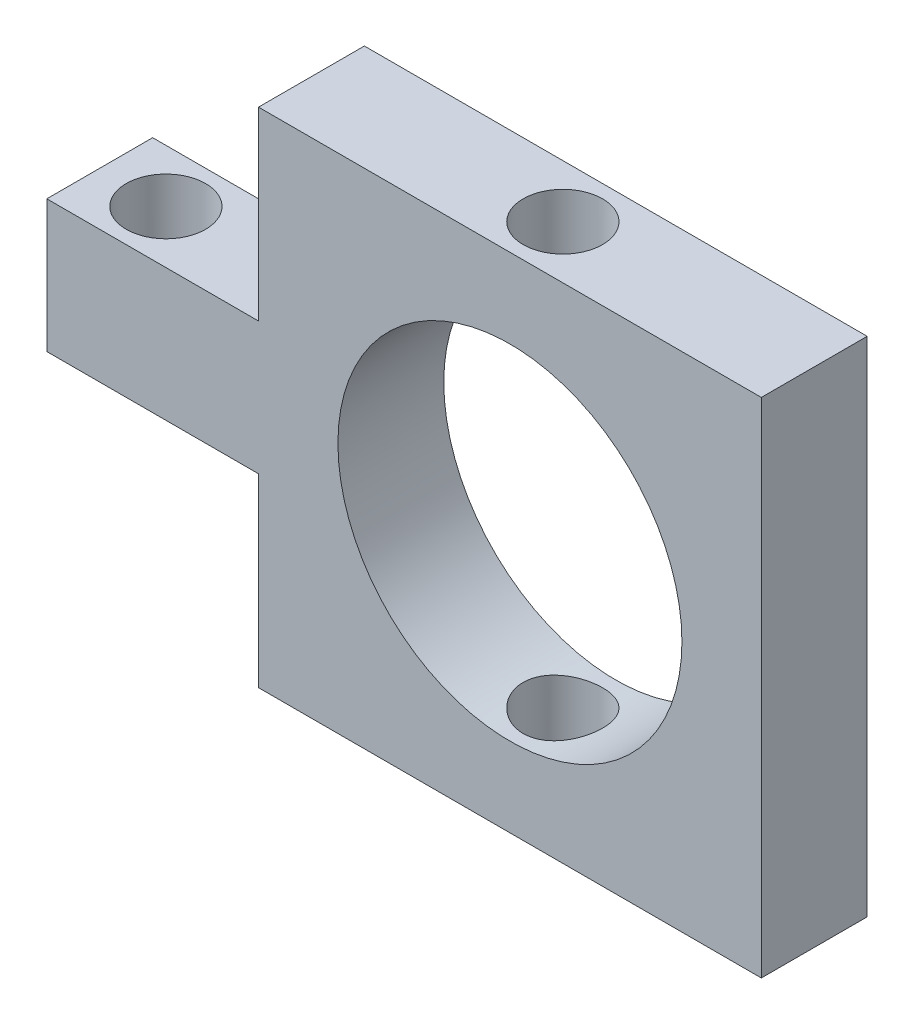
from build123d import *

# Parameters (mm, degrees)
SKETCH1_W                      = 19
SKETCH1_H                      = 19
SKETCH1_R                      = 6.5
BOSS_EXTRUDE1_DEPTH            = 4
CUT_EXTRUDE1_REACH             = 16.018
SKETCH2_R                      = 1.5
CUT_EXTRUDE1_DIRECTION_2_REACH = 16.018
SKETCH5_W                      = 4
SKETCH5_H                      = 5
BOSS_EXTRUDE3_DEPTH            = 8
CUT_EXTRUDE2_REACH             = 22.31
SKETCH7_R                      = 1.5
CUT_EXTRUDE2_DIRECTION_2_REACH = 22.31


with BuildPart() as part:
    # Sketch1 → Boss-Extrude1 (new body)
    with BuildSketch(Plane.XY):
        Rectangle(SKETCH1_W, SKETCH1_H)
        Circle(SKETCH1_R, mode=Mode.SUBTRACT)
    extrude(amount=BOSS_EXTRUDE1_DEPTH)

    # Sketch2 → Cut-Extrude1 (cut, up to next)
    with BuildSketch(Plane(origin=(0, 0, 0), x_dir=(1, 0, 0), z_dir=(0, 1, 0)), mode=Mode.PRIVATE) as cut_extrude1_sk1:
        with Locations(Location((0, -2, 0), (0, 0, 90))):
            Circle(SKETCH2_R)
    cut_extrude1_tool1 = extrude(cut_extrude1_sk1.sketch, amount=CUT_EXTRUDE1_REACH, mode=Mode.PRIVATE) & part.part
    add(cut_extrude1_tool1.solids().sort_by_distance((0, 0, 2))[0], mode=Mode.SUBTRACT)

    # Sketch2 → Cut-Extrude1 direction 2 (cut, up to next)
    with BuildSketch(Plane(origin=(0, 0, 0), x_dir=(1, 0, 0), z_dir=(0, 1, 0)), mode=Mode.PRIVATE) as cut_extrude1_direction_2_sk1:
        with Locations(Location((0, -2, 0), (0, 0, 90))):
            Circle(SKETCH2_R)
    cut_extrude1_direction_2_tool1 = extrude(cut_extrude1_direction_2_sk1.sketch, amount=-CUT_EXTRUDE1_DIRECTION_2_REACH, mode=Mode.PRIVATE) & part.part
    add(cut_extrude1_direction_2_tool1.solids().sort_by_distance((0, 0, 2))[0], mode=Mode.SUBTRACT)

    # Sketch5 → Boss-Extrude3 (add)
    with BuildSketch(Plane.ZY.offset(9.5)):
        with Locations((2, 0)):
            Rectangle(SKETCH5_W, SKETCH5_H)
    extrude(amount=BOSS_EXTRUDE3_DEPTH)

    # Sketch7 → Cut-Extrude2 (cut, up to next)
    with BuildSketch(Plane(origin=(0, 0, 0), x_dir=(1, 0, 0), z_dir=(0, 1, 0)), mode=Mode.PRIVATE) as cut_extrude2_sk1:
        with Locations(Location((-15, -2, 0), (0, 0, 90))):
            Circle(SKETCH7_R)
    cut_extrude2_tool1 = extrude(cut_extrude2_sk1.sketch, amount=-CUT_EXTRUDE2_REACH, mode=Mode.PRIVATE) & part.part
    add(cut_extrude2_tool1.solids().sort_by_distance((-15, 0, 2))[0], mode=Mode.SUBTRACT)

    # Sketch7 → Cut-Extrude2 direction 2 (cut, up to next)
    with BuildSketch(Plane(origin=(0, 0, 0), x_dir=(1, 0, 0), z_dir=(0, 1, 0)), mode=Mode.PRIVATE) as cut_extrude2_direction_2_sk1:
        with Locations(Location((-15, -2, 0), (0, 0, 90))):
            Circle(SKETCH7_R)
    cut_extrude2_direction_2_tool1 = extrude(cut_extrude2_direction_2_sk1.sketch, amount=CUT_EXTRUDE2_DIRECTION_2_REACH, mode=Mode.PRIVATE) & part.part
    add(cut_extrude2_direction_2_tool1.solids().sort_by_distance((-15, 0, 2))[0], mode=Mode.SUBTRACT)


solid = part.part
